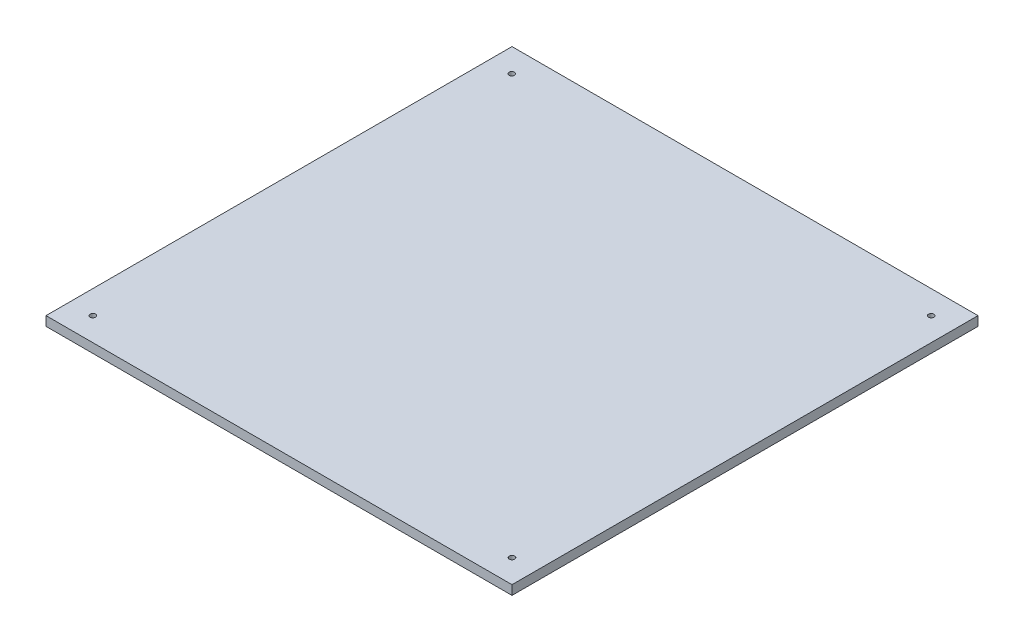
from build123d import *

# Parameters (mm, degrees)
SKETCH3_W           = 300
SKETCH3_H           = 300
BOSS_EXTRUDE1_DEPTH = 6
SKETCH6_R           = 1.75
CUT_EXTRUDE1_DEPTH  = 6
SKETCH15_R          = 1.75
CUT_EXTRUDE6_DEPTH  = 6
SKETCH17_R          = 1.75
CUT_EXTRUDE7_DEPTH  = 6
SKETCH16_R          = 1.75
CUT_EXTRUDE8_DEPTH  = 6


with BuildPart() as part:
    # Sketch3 → Boss-Extrude1 (new body)
    with BuildSketch(Plane(origin=(0, 0, 0), x_dir=(1, 0, 0), z_dir=(0, 1, 0))):
        with Locations((78.625607261, 107.505441411)):
            Rectangle(SKETCH3_W, SKETCH3_H)
    extrude(amount=BOSS_EXTRUDE1_DEPTH)

    # Sketch6 → Cut-Extrude1 (cut)
    with BuildSketch(Plane(origin=(0, 6, 0), x_dir=(1, 0, 0), z_dir=(0, 1, 0))):
        with Locations(Location((-56.304099694, 242.248751528, 0), (0, 0, 270))):
            Circle(SKETCH6_R)
    extrude(amount=-CUT_EXTRUDE1_DEPTH, mode=Mode.SUBTRACT)

    # Sketch15 → Cut-Extrude6 (cut)
    with BuildSketch(Plane(origin=(0, 6, 0), x_dir=(1, 0, 0), z_dir=(0, 1, 0))):
        with Locations(Location((213.517450934, -27.406864844, 0), (0, 0, 270))):
            Circle(SKETCH15_R)
    extrude(amount=-CUT_EXTRUDE6_DEPTH, mode=Mode.SUBTRACT)

    # Sketch17 → Cut-Extrude7 (cut)
    with BuildSketch(Plane(origin=(0, 6, 0), x_dir=(1, 0, 0), z_dir=(0, 1, 0))):
        with Locations(Location((213.59518727, 242.436845066, 0), (0, 0, 270))):
            Circle(SKETCH17_R)
    extrude(amount=-CUT_EXTRUDE7_DEPTH, mode=Mode.SUBTRACT)

    # Sketch16 → Cut-Extrude8 (cut)
    with BuildSketch(Plane(origin=(0, 6, 0), x_dir=(1, 0, 0), z_dir=(0, 1, 0))):
        with Locations(Location((-56.288428498, -27.427945412, 0), (0, 0, 270))):
            Circle(SKETCH16_R)
    extrude(amount=-CUT_EXTRUDE8_DEPTH, mode=Mode.SUBTRACT)


solid = part.part
